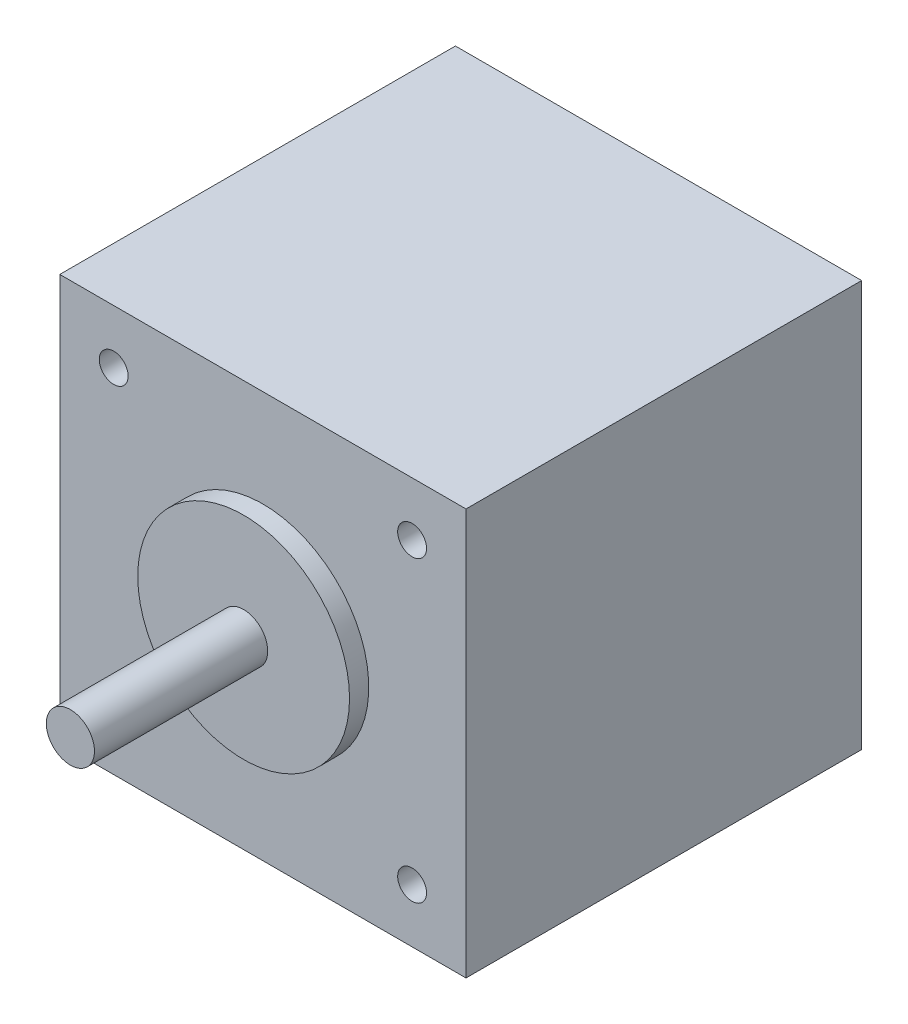
from build123d import *

# Parameters (mm, degrees)
ESQUISSE1_W      = 42.2
ESQUISSE1_H      = 42.2
EXTRUSION1_DEPTH = 41.1
ESQUISSE2_R      = 11
EXTRUSION2_DEPTH = 2
ESQUISSE3_R      = 2.5
EXTRUSION3_DEPTH = 18
ESQUISSE4_R      = 1.5
EXTRUSION4_DEPTH = 4


with BuildPart() as part:
    # Esquisse1 → Extrusion1 (new body)
    with BuildSketch(Plane.XY):
        with Locations((7.023594794, 4.422730203)):
            Rectangle(ESQUISSE1_W, ESQUISSE1_H)
    extrude(amount=EXTRUSION1_DEPTH)

    # Esquisse2 → Extrusion2 (add)
    with BuildSketch(Plane.XY.offset(41.1)):
        with Locations(Location((7.023594794, 4.422730203, 0), (0, 0, 180))):
            Circle(ESQUISSE2_R)
    extrude(amount=EXTRUSION2_DEPTH)

    # Esquisse3 → Extrusion3 (add)
    with BuildSketch(Plane.XY.offset(43.1)):
        with Locations((7.023594794, 4.422730203)):
            Circle(ESQUISSE3_R)
    extrude(amount=EXTRUSION3_DEPTH)

    # Esquisse4 → Extrusion4 (cut)
    with BuildSketch(Plane.XY.offset(41.1)):
        with Locations((-8.476405206, 19.922730203)):
            Circle(ESQUISSE4_R)
        with Locations(Location((22.523594794, 19.922730203, 0), (0, 0, 180))):
            Circle(ESQUISSE4_R)
        with Locations((22.523594794, -11.077269797)):
            Circle(ESQUISSE4_R)
        with Locations(Location((-8.476405206, -11.077269797, 0), (0, 0, 180))):
            Circle(ESQUISSE4_R)
    extrude(amount=-EXTRUSION4_DEPTH, mode=Mode.SUBTRACT)


solid = part.part
